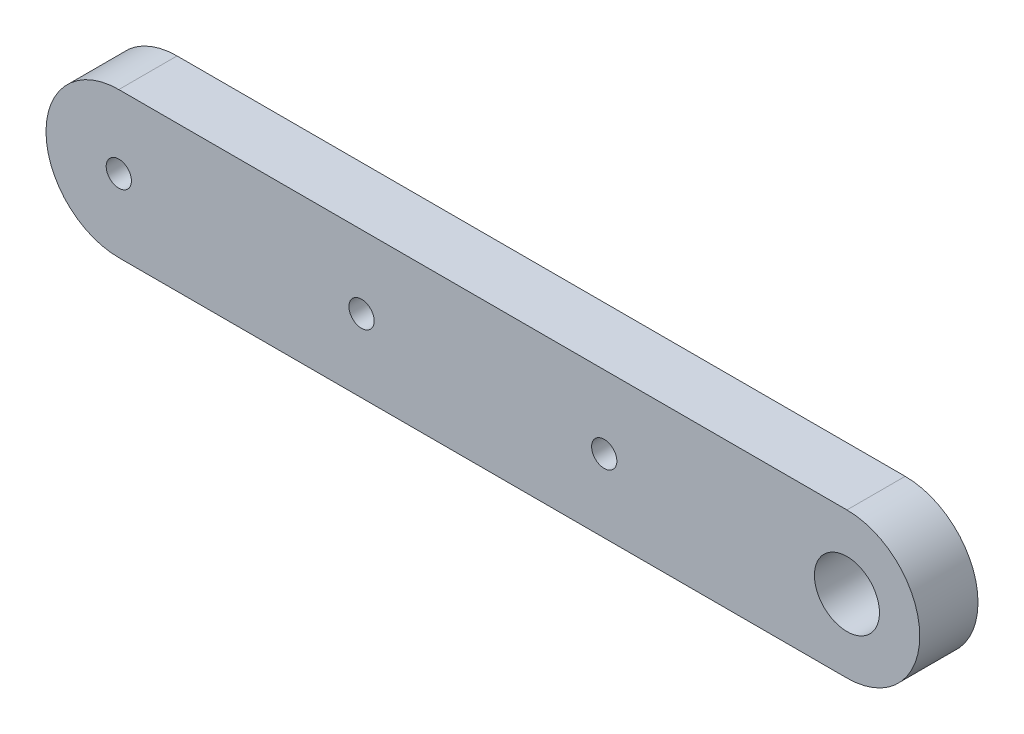
from build123d import *

# Parameters (mm, degrees)
SKETCH1_R           = 7.5
BOSS_EXTRUDE1_DEPTH = 6
SKETCH2_R           = 1.3
CUT_EXTRUDE1_DEPTH  = 84.057209199
LPATTERN1_COUNT     = 4
LPATTERN1_PITCH     = 25
SKETCH3_R           = 3.35
CUT_EXTRUDE2_DEPTH  = 84.057209199


with BuildPart() as part:
    # Sketch1 → Boss-Extrude1 (new body)
    with BuildSketch(Plane.XY):
        with BuildLine():
            Line((75, 7.5), (0, 7.5))
            ThreePointArc((0, 7.5), (5.303300859, 5.303300859), (7.5, 0))
            ThreePointArc((7.5, 0), (5.303300859, -5.303300859), (0, -7.5))
            Line((0, -7.5), (75, -7.5))
            ThreePointArc((75, -7.5), (67.5, 0), (75, 7.5))
        make_face()
        with Locations((75, 0)):
            Circle(SKETCH1_R)
        Circle(SKETCH1_R)
    extrude(amount=BOSS_EXTRUDE1_DEPTH)

    # Sketch2 → Cut-Extrude1 (cut, through all)
    with BuildSketch(Plane.XY.offset(6)):
        Circle(SKETCH2_R)
        with Locations((75, 0)):
            Circle(SKETCH2_R)
    cut_extrude1 = extrude(amount=-CUT_EXTRUDE1_DEPTH, mode=Mode.SUBTRACT)

    # LPattern1: Cut-Extrude1 ×4
    with Locations(*[(i * LPATTERN1_PITCH, 0, 0) for i in range(1, LPATTERN1_COUNT)]):
        add(cut_extrude1, mode=Mode.SUBTRACT)

    # Sketch3 → Cut-Extrude2 (cut, through all)
    with BuildSketch(Plane.XY.offset(6)):
        with Locations((75, 0)):
            Circle(SKETCH3_R)
    extrude(amount=-CUT_EXTRUDE2_DEPTH, mode=Mode.SUBTRACT)


solid = part.part
